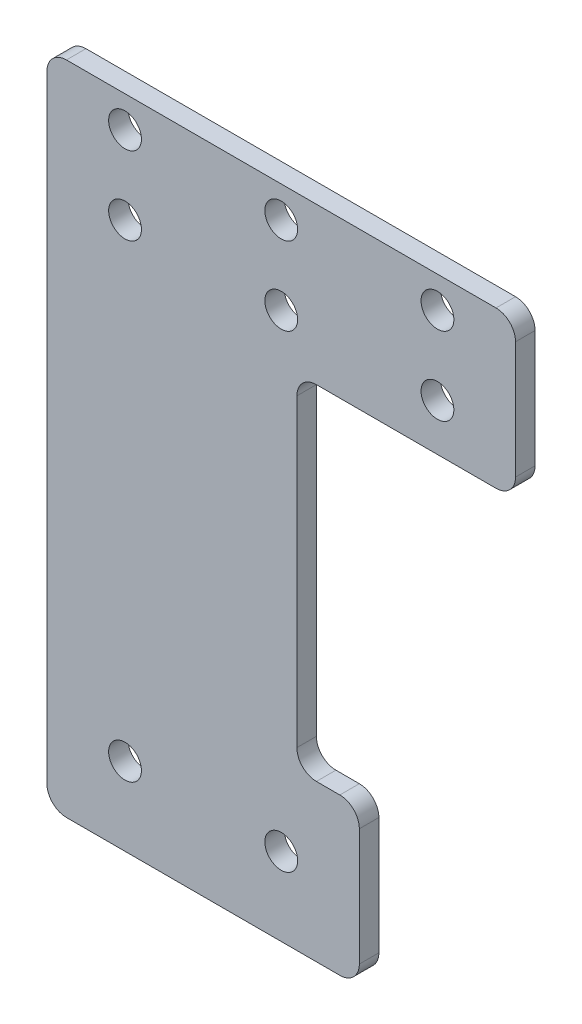
from build123d import *

# Parameters (mm, degrees)
SKETCH1_R           = 2.667
BOSS_EXTRUDE1_DEPTH = 3.175
FILLET1_R           = 3.175


with BuildPart() as part:
    # Sketch1 → Boss-Extrude1 (new body)
    # profile 1 of 2: a face of its own
    with BuildSketch(Plane.XY):
        with BuildLine():
            Line((0, 106.68), (0, 0))
            Line((0, 0), (40.64, 0))
            Line((40.64, 0), (40.64, 11.886803222))
            ThreePointArc((40.64, 11.886803222), (35.433, 12.7), (40.64, 13.513196778))
            Line((40.64, 13.513196778), (40.64, 25.4))
            Line((40.64, 25.4), (40.64, 81.28))
            Line((40.64, 81.28), (50.8, 81.28))
            Line((50.8, 81.28), (76.2, 81.28))
            Line((76.2, 81.28), (76.2, 106.68))
            Line((76.2, 106.68), (0, 106.68))
        make_face()
        with Locations((12.7, 12.7)):
            Circle(SKETCH1_R, mode=Mode.SUBTRACT)
        with Locations((12.7, 88.9)):
            Circle(SKETCH1_R, mode=Mode.SUBTRACT)
        with Locations((12.7, 101.6)):
            Circle(SKETCH1_R, mode=Mode.SUBTRACT)
        with Locations((38.1, 101.6)):
            Circle(SKETCH1_R, mode=Mode.SUBTRACT)
        with Locations((38.1, 88.9)):
            Circle(SKETCH1_R, mode=Mode.SUBTRACT)
        with Locations((63.5, 88.9)):
            Circle(SKETCH1_R, mode=Mode.SUBTRACT)
        with Locations((63.5, 101.6)):
            Circle(SKETCH1_R, mode=Mode.SUBTRACT)
    # profile 2 of 2: a face of its own
    with BuildSketch(Plane.XY):
        with BuildLine():
            Line((40.64, 11.886803222), (40.64, 0))
            Line((40.64, 0), (50.8, 0))
            Line((50.8, 0), (50.8, 25.4))
            Line((50.8, 25.4), (40.64, 25.4))
            Line((40.64, 25.4), (40.64, 13.513196778))
            ThreePointArc((40.64, 13.513196778), (40.735058728, 13.111527034), (40.767, 12.7))
            ThreePointArc((40.767, 12.7), (40.735058728, 12.288472966), (40.64, 11.886803222))
        make_face()
    extrude(amount=BOSS_EXTRUDE1_DEPTH)

    # Fillet1
    fillet1_edges = [part.edges().sort_by_distance(p)[0] for p in [
        (50.8, 25.4, 1.5875),
        (50.8, 0, 1.5875),
        (0, 0, 1.5875),
        (0, 106.68, 1.5875),
        (76.2, 106.68, 1.5875),
        (76.2, 81.28, 1.5875),
        (40.64, 81.28, 1.5875),
        (40.64, 25.4, 1.5875),
    ]]
    fillet(fillet1_edges, radius=FILLET1_R)


solid = part.part
